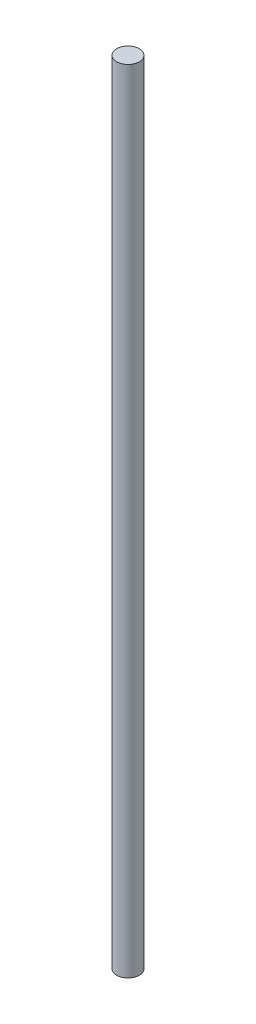
from build123d import *

# Parameters (mm, degrees)
SKETCH_1_R      = 1
EXTRUDE_1_DEPTH = 70


with BuildPart() as part:
    # 草图1 → 凸台-拉伸1 (new body)
    with BuildSketch(Plane(origin=(0, 0, 0), x_dir=(1, 0, 0), z_dir=(0, 1, 0))):
        with Locations(Location((0, 0, 0), (0, 0, 270))):
            Circle(SKETCH_1_R)
    extrude(amount=EXTRUDE_1_DEPTH)


solid = part.part
